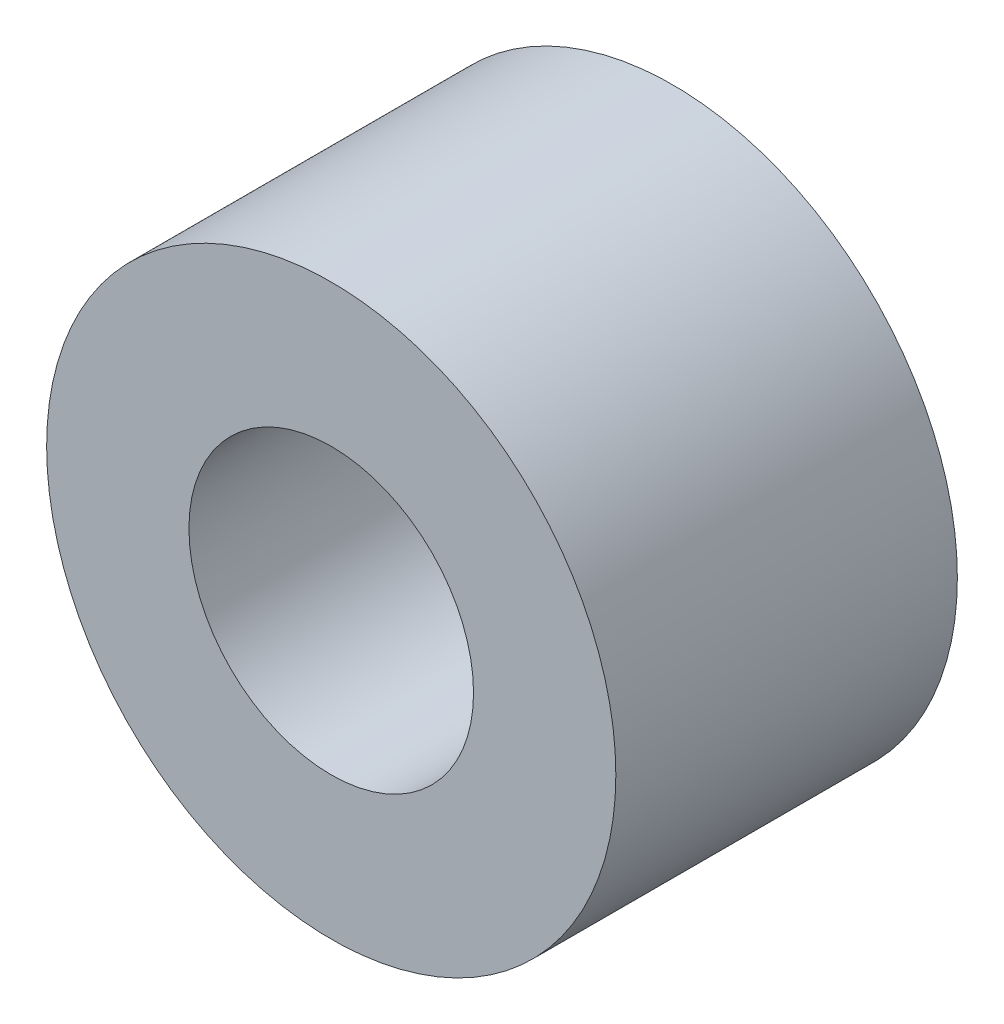
from build123d import *

# Parameters (mm, degrees)
SZKIC1_R                    = 5
SZKIC1_R_2                  = 2.5
DODANIE_WYCI_GNI_CIE1_DEPTH = 6


with BuildPart() as part:
    # Szkic1 → Dodanie-wyciągnięcie1 (new body)
    with BuildSketch(Plane.XY):
        Circle(SZKIC1_R)
        Circle(SZKIC1_R_2, mode=Mode.SUBTRACT)
    extrude(amount=DODANIE_WYCI_GNI_CIE1_DEPTH)


solid = part.part
